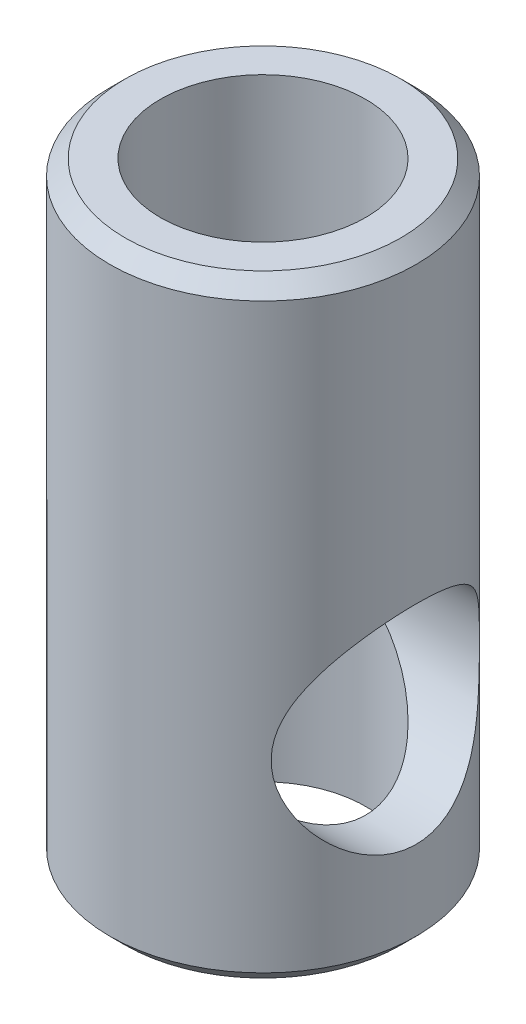
from build123d import *

# Parameters (mm, degrees)
SKETCH_1_W               = 5
SKETCH_1_H               = 20
SKETCH_3_R               = 3.35
CUT_EXTRUDE_1_DEPTH      = 22.213203436
CUT_EXTRUDE_2_DEPTH      = 22.213203436
CUT_EXTRUDE_2_DEPTH_BACK = 22.213203436
SKETCH_4_R               = 3.4
CHAMFER_1_SIZE           = 0.5


with BuildPart() as part:
    # 草图1 → 旋转1 (revolve)
    with BuildSketch(Plane.XY, mode=Mode.PRIVATE) as revolve_1_sk:
        with Locations((2.5, 10)):
            Rectangle(SKETCH_1_W, SKETCH_1_H)
    revolve(revolve_1_sk.sketch.rotate(Axis((0, 20, 0), (0, 1, 0)), 270), axis=Axis((0, 20, 0), (0, 1, 0)))

    # 草图3 → 切除-拉伸1 (cut, through all)
    with BuildSketch(Plane(origin=(0, 20, 0), x_dir=(1, 0, 0), z_dir=(0, 1, 0))):
        with Locations(Location((0, 0, 0), (0, 0, 270))):
            Circle(SKETCH_3_R)
    extrude(amount=-CUT_EXTRUDE_1_DEPTH, mode=Mode.SUBTRACT)

    # 草图4 → 切除-拉伸2 (cut, two sides: drawn at the far end of the back side and taken through both)
    with BuildSketch(Plane(origin=(0, 0, 0), x_dir=(0, 0, -1), z_dir=(1, 0, 0)).offset(-CUT_EXTRUDE_2_DEPTH_BACK)):
        with Locations((0, 6.5)):
            Circle(SKETCH_4_R)
    extrude(amount=CUT_EXTRUDE_2_DEPTH + CUT_EXTRUDE_2_DEPTH_BACK, mode=Mode.SUBTRACT)

    # 倒角1
    chamfer_1_edges = [part.edges().sort_by_distance(p)[0] for p in [
        (0, 20, -5),
        (0, 0, -5),
    ]]
    chamfer(chamfer_1_edges, length=CHAMFER_1_SIZE)


solid = part.part
